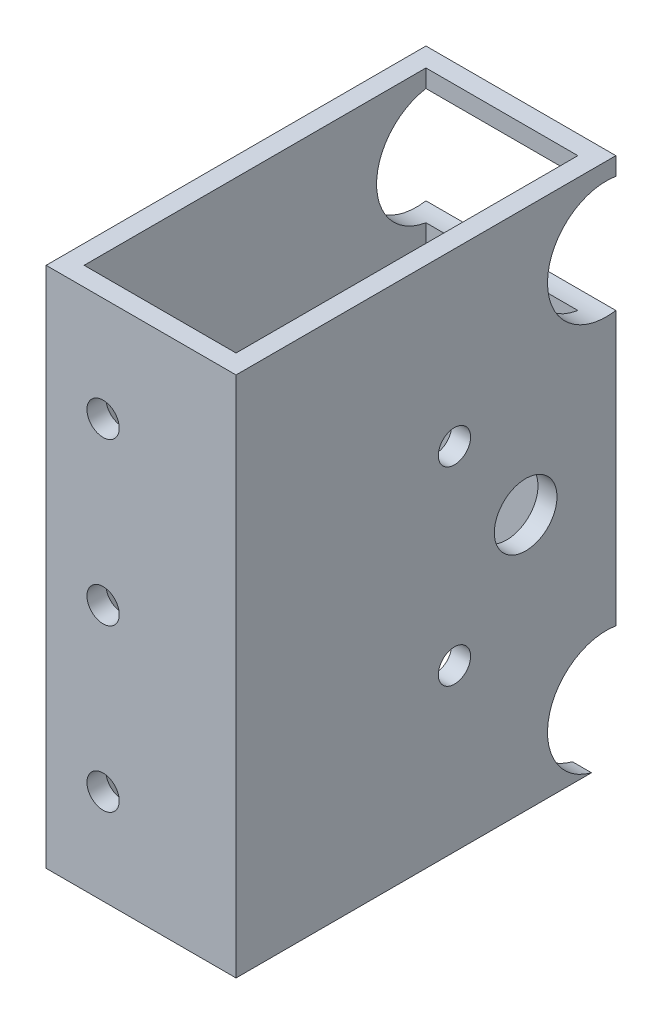
from build123d import *

# Parameters (mm, degrees)
STEEL_TUBE_STOCK_SKETCH_W        = 20
STEEL_TUBE_STOCK_SKETCH_H        = 55
STEEL_TUBE_STOCK_DEPTH           = 40
TUBE_INTERIOR_SKETCH_W           = 16
TUBE_INTERIOR_SKETCH_H           = 55.2
TUBE_INTERIOR_DEPTH              = 36
GUIDE_BUSH_CLEARANCE_1_SKETCH_R  = 6.2
GUIDE_BUSH_CLEARANCE_1_DEPTH     = 20.3
GUIDE_BUSH_CLEARANCE_2_SKETCH_R  = 6.2
GUIDE_BUSH_CLEARANCE_2_DEPTH     = 20.3
SCREW_THROUGH_CLEARANCE_SKETCH_R = 3.3
SCREW_THROUGH_CLEARANCE_DEPTH    = 20.3
SPRING_PIN_CLEARANCE_1_SKETCH_R  = 1.7
SPRING_PIN_CLEARANCE_1_DEPTH     = 2.2
SPRING_PIN_CLEARANCE_2_SKETCH_R  = 1.7
SPRING_PIN_CLEARANCE_2_DEPTH     = 2.2
SPRING_PIN_CLEARANCE_3_SKETCH_R  = 1.7
SPRING_PIN_CLEARANCE_3_DEPTH     = 2.2
CLAMP_BOLT_CLEARANCE_1_SKETCH_R  = 1.7
CLAMP_BOLT_CLEARANCE_1_DEPTH     = 2.3
CLAMP_BOLT_CLEARANCE_2_SKETCH_R  = 1.7
CLAMP_BOLT_CLEARANCE_2_DEPTH     = 2.3


with BuildPart() as part:
    # Steel tube stock sketch → Steel tube stock (new body)
    with BuildSketch(Plane.XY.offset(-29)):
        with Locations((39.708348754, -28.5)):
            Rectangle(STEEL_TUBE_STOCK_SKETCH_W, STEEL_TUBE_STOCK_SKETCH_H)
    extrude(amount=STEEL_TUBE_STOCK_DEPTH)

    # Tube interior sketch → Tube interior (cut)
    with BuildSketch(Plane.XY.offset(-27)):
        with Locations((39.708348754, -28.5)):
            Rectangle(TUBE_INTERIOR_SKETCH_W, TUBE_INTERIOR_SKETCH_H)
    extrude(amount=TUBE_INTERIOR_DEPTH, mode=Mode.SUBTRACT)

    # Guide bush clearance 1 sketch → Guide bush clearance 1 (cut)
    with BuildSketch(Plane(origin=(29.6, 0, 0), x_dir=(0, 0, -1), z_dir=(1, 0, 0))):
        with Locations((28, -9)):
            Circle(GUIDE_BUSH_CLEARANCE_1_SKETCH_R)
    extrude(amount=GUIDE_BUSH_CLEARANCE_1_DEPTH, mode=Mode.SUBTRACT)

    # Guide bush clearance 2 sketch → Guide bush clearance 2 (cut)
    with BuildSketch(Plane(origin=(29.6, 0, 0), x_dir=(0, 0, -1), z_dir=(1, 0, 0))):
        with Locations((28, -50)):
            Circle(GUIDE_BUSH_CLEARANCE_2_SKETCH_R)
    extrude(amount=GUIDE_BUSH_CLEARANCE_2_DEPTH, mode=Mode.SUBTRACT)

    # Screw through clearance sketch → Screw through clearance (cut)
    with BuildSketch(Plane(origin=(29.6, 0, 0), x_dir=(0, 0, -1), z_dir=(1, 0, 0))):
        with Locations(Location((19.5, -29, 0), (0, 0, 180))):
            Circle(SCREW_THROUGH_CLEARANCE_SKETCH_R)
    extrude(amount=SCREW_THROUGH_CLEARANCE_DEPTH, mode=Mode.SUBTRACT)

    # Spring pin clearance 1 sketch → Spring pin clearance 1 (cut)
    with BuildSketch(Plane.XY.offset(8.9)):
        with Locations((35.708348754, -12)):
            Circle(SPRING_PIN_CLEARANCE_1_SKETCH_R)
    extrude(amount=SPRING_PIN_CLEARANCE_1_DEPTH, mode=Mode.SUBTRACT)

    # Spring pin clearance 2 sketch → Spring pin clearance 2 (cut)
    with BuildSketch(Plane.XY.offset(8.9)):
        with Locations((35.708348754, -29)):
            Circle(SPRING_PIN_CLEARANCE_2_SKETCH_R)
    extrude(amount=SPRING_PIN_CLEARANCE_2_DEPTH, mode=Mode.SUBTRACT)

    # Spring pin clearance 3 sketch → Spring pin clearance 3 (cut)
    with BuildSketch(Plane.XY.offset(8.9)):
        with Locations((35.708348754, -46)):
            Circle(SPRING_PIN_CLEARANCE_3_SKETCH_R)
    extrude(amount=SPRING_PIN_CLEARANCE_3_DEPTH, mode=Mode.SUBTRACT)

    # Clamp bolt clearance 1 sketch → Clamp bolt clearance 1 (cut)
    with BuildSketch(Plane(origin=(47.6, 0, 0), x_dir=(0, 0, -1), z_dir=(1, 0, 0))):
        with Locations(Location((12, -19, 0), (0, 0, 180))):
            Circle(CLAMP_BOLT_CLEARANCE_1_SKETCH_R)
    extrude(amount=CLAMP_BOLT_CLEARANCE_1_DEPTH, mode=Mode.SUBTRACT)

    # Clamp bolt clearance 2 sketch → Clamp bolt clearance 2 (cut)
    with BuildSketch(Plane(origin=(47.6, 0, 0), x_dir=(0, 0, -1), z_dir=(1, 0, 0))):
        with Locations(Location((12, -39, 0), (0, 0, 180))):
            Circle(CLAMP_BOLT_CLEARANCE_2_SKETCH_R)
    extrude(amount=CLAMP_BOLT_CLEARANCE_2_DEPTH, mode=Mode.SUBTRACT)


solid = part.part
